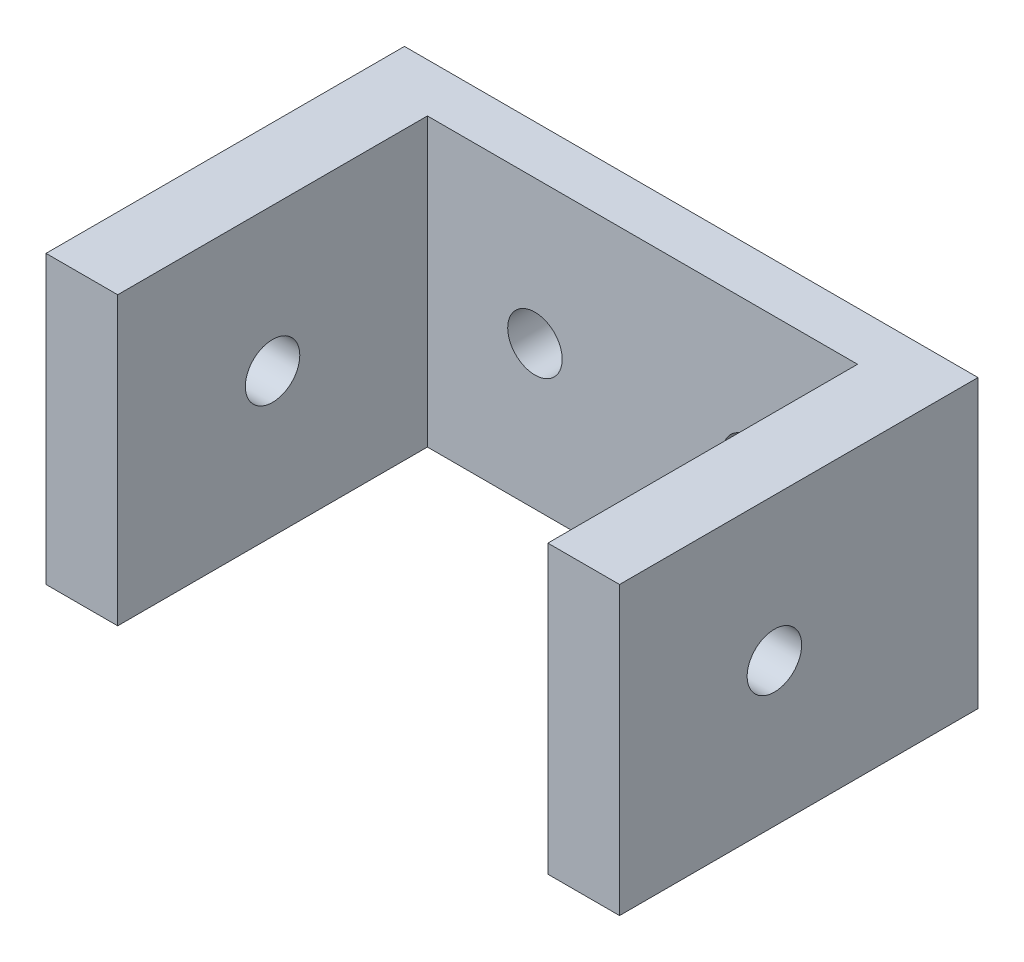
from build123d import *

# Parameters (mm, degrees)
SKETCH1_W               = 50.8
SKETCH1_H               = 25.4
BOSS_EXTRUDE1_DEPTH     = 4.318
SKETCH2_W               = 6.35
SKETCH2_H               = 25.4
BOSS_EXTRUDE2_DEPTH     = 27.432
SKETCH4_R               = 2.413
CUT_EXTRUDE1_DEPTH      = 4.318
CUT_EXTRUDE2_DEPTH      = 57.081681501
CUT_EXTRUDE2_DEPTH_BACK = 57.081681501
SKETCH5_R               = 2.413


with BuildPart() as part:
    # Sketch1 → Boss-Extrude1 (new body)
    with BuildSketch(Plane.XY):
        Rectangle(SKETCH1_W, SKETCH1_H)
    extrude(amount=BOSS_EXTRUDE1_DEPTH)

    # Sketch2 → Boss-Extrude2 (add)
    with BuildSketch(Plane.XY.offset(4.318)):
        with Locations((-22.225, 0)):
            Rectangle(SKETCH2_W, SKETCH2_H)
        with Locations((22.225, 0)):
            Rectangle(SKETCH2_W, SKETCH2_H)
    extrude(amount=BOSS_EXTRUDE2_DEPTH)

    # Sketch4 → Cut-Extrude1 (cut)
    with BuildSketch(Plane(origin=(0, 0, 0), x_dir=(-1, 0, 0), z_dir=(0, 0, -1))):
        with Locations((-9.525, 0)):
            Circle(SKETCH4_R)
        with Locations((9.525, 0)):
            Circle(SKETCH4_R)
    extrude(amount=-CUT_EXTRUDE1_DEPTH, mode=Mode.SUBTRACT)

    # Sketch5 → Cut-Extrude2 (cut, two sides: drawn at the far end of the back side and taken through both)
    with BuildSketch(Plane(origin=(-19.05, 0, 0), x_dir=(0, 0, -1), z_dir=(1, 0, 0)).offset(-CUT_EXTRUDE2_DEPTH_BACK)):
        with Locations((-18.034, 0)):
            Circle(SKETCH5_R)
    extrude(amount=CUT_EXTRUDE2_DEPTH + CUT_EXTRUDE2_DEPTH_BACK, mode=Mode.SUBTRACT)


solid = part.part
